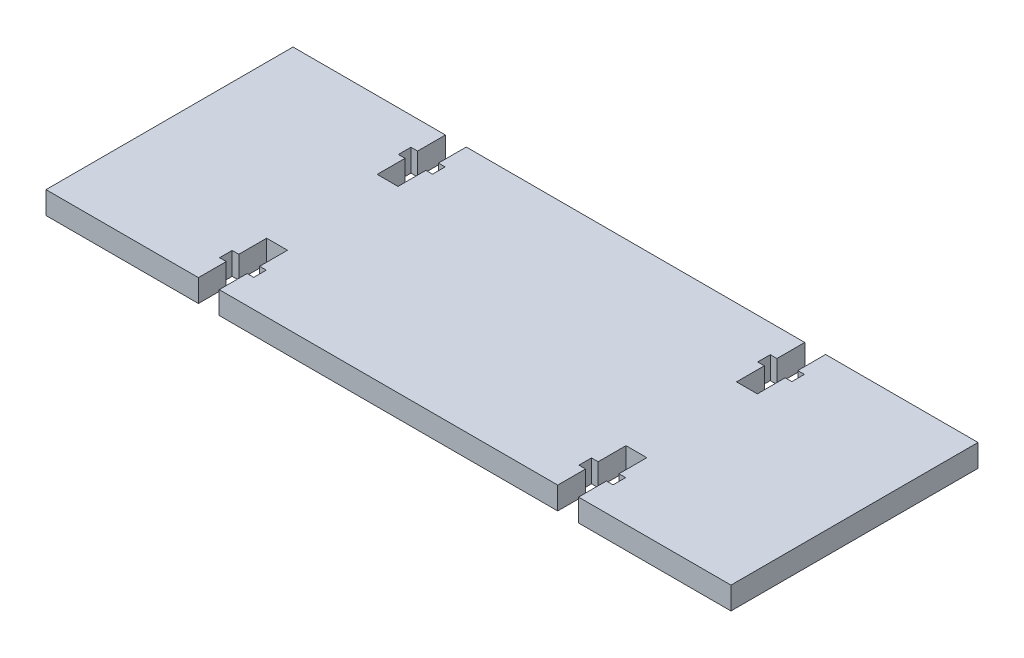
from build123d import *

# Parameters (mm, degrees)
SKETCH1_W           = 96.8375
SKETCH1_H           = 34.925
BOSS_EXTRUDE1_DEPTH = 3.175
CUT_EXTRUDE2_DEPTH  = 52.56932114


with BuildPart() as part:
    # Sketch1 → Boss-Extrude1 (new body)
    with BuildSketch(Plane(origin=(0, 0, 0), x_dir=(1, 0, 0), z_dir=(0, 1, 0))):
        Rectangle(SKETCH1_W, SKETCH1_H)
    extrude(amount=BOSS_EXTRUDE1_DEPTH)

    # Sketch3 → Cut-Extrude2 (cut, through all)
    with BuildSketch(Plane(origin=(0, 3.175, 0), x_dir=(1, 0, 0), z_dir=(0, 1, 0))):
        Polygon((-26.8732, 17.4625), (-23.9268, 17.4625), (-23.9268, 13.5255), (-22.987, 13.5255), (-22.987, 11.7475), (-23.9268, 11.7475), (-23.9268, 7.8105), (-26.8732, 7.8105), (-26.8732, 11.7475), (-27.813, 11.7475), (-27.813, 13.5255), (-26.8732, 13.5255), align=None)
        Polygon((23.9268, 17.4625), (26.8732, 17.4625), (26.8732, 13.5255), (27.813, 13.5255), (27.813, 11.7475), (26.8732, 11.7475), (26.8732, 7.8105), (23.9268, 7.8105), (23.9268, 11.7475), (22.987, 11.7475), (22.987, 13.5255), (23.9268, 13.5255), align=None)
        Polygon((26.8732, -11.7475), (26.8732, -7.8105), (23.9268, -7.8105), (23.9268, -11.7475), (22.987, -11.7475), (22.987, -13.5255), (23.9268, -13.5255), (23.9268, -17.4625), (26.8732, -17.4625), (26.8732, -13.5255), (27.813, -13.5255), (27.813, -11.7475), align=None)
        Polygon((-23.9268, -11.7475), (-23.9268, -7.8105), (-26.8732, -7.8105), (-26.8732, -11.7475), (-27.813, -11.7475), (-27.813, -13.5255), (-26.8732, -13.5255), (-26.8732, -17.4625), (-23.9268, -17.4625), (-23.9268, -13.5255), (-22.987, -13.5255), (-22.987, -11.7475), align=None)
    extrude(amount=-CUT_EXTRUDE2_DEPTH, mode=Mode.SUBTRACT)


solid = part.part
